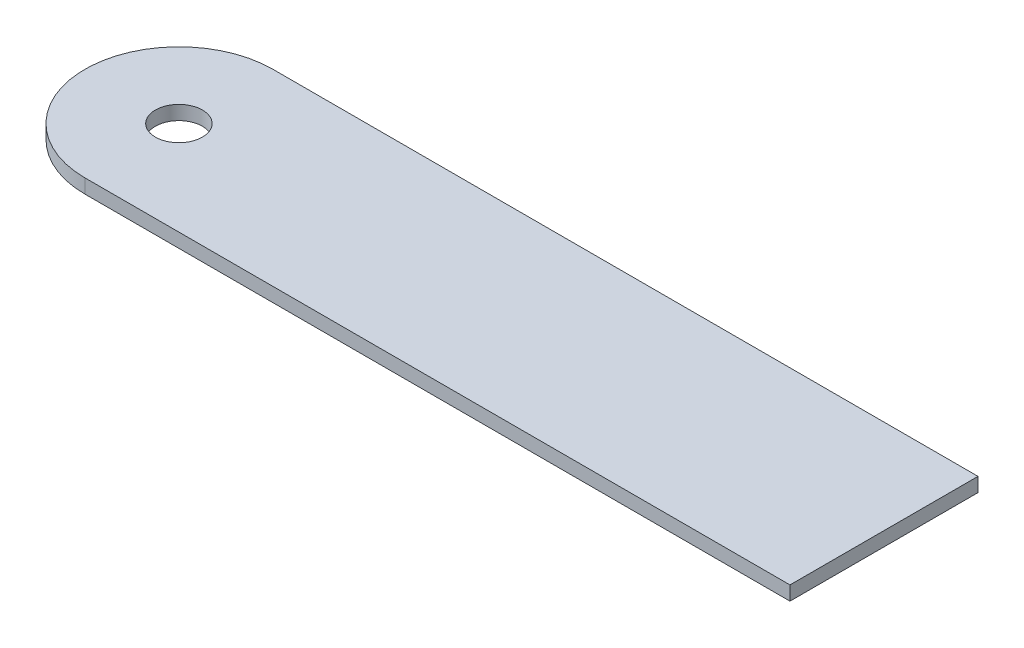
from build123d import *

# Parameters (mm, degrees)
BOSS_EXTRUDE1_DEPTH = 3


with BuildPart() as part:
    # Sketch1 → Boss-Extrude1 (new body)
    with BuildSketch(Plane(origin=(0, 0, 0), x_dir=(1, 0, 0), z_dir=(0, 1, 0))):
        with BuildLine():
            ThreePointArc((-75, 20), (-95, 0), (-75, -20))
            Line((-75, -20), (-75, -5))
            ThreePointArc((-75, -5), (-80, 0), (-75, 5))
            Line((-75, 5), (-75, 20))
        make_face()
        with BuildLine():
            Line((-75, -5), (-75, -20))
            ThreePointArc((-75, -20), (-60.857864376, -14.142135624), (-55, 0))
            ThreePointArc((-55, 0), (-60.857864376, 14.142135624), (-75, 20))
            Line((-75, 20), (-75, 5))
            ThreePointArc((-75, 5), (-71.464466094, 3.535533906), (-70, 0))
            ThreePointArc((-70, 0), (-71.464466094, -3.535533906), (-75, -5))
        make_face()
        with BuildLine():
            ThreePointArc((-55, 0), (-60.857864376, -14.142135624), (-75, -20))
            Line((-75, -20), (75, -20))
            Line((75, -20), (75, 20))
            Line((75, 20), (-75, 20))
            ThreePointArc((-75, 20), (-60.857864376, 14.142135624), (-55, 0))
        make_face()
    extrude(amount=BOSS_EXTRUDE1_DEPTH)


solid = part.part
